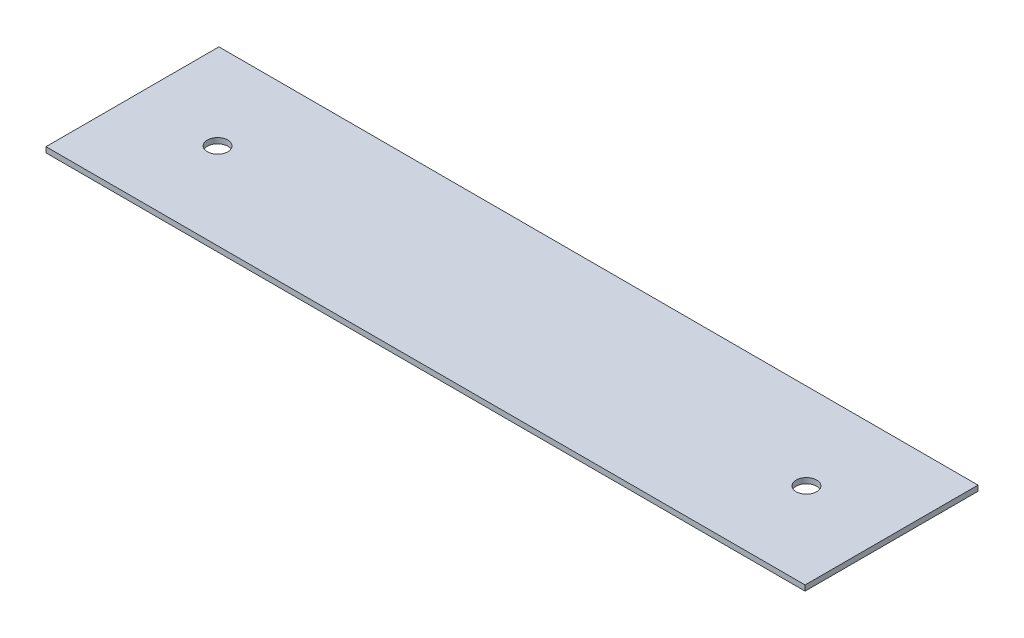
from build123d import *

# Parameters (mm, degrees)
SKETCH1_W           = 446
SKETCH1_H           = 101.6
BOSS_EXTRUDE1_DEPTH = 3.175
SKETCH2_R           = 6
CUT_EXTRUDE1_DEPTH  = 10


with BuildPart() as part:
    # Sketch1 → Boss-Extrude1 (new body)
    with BuildSketch(Plane(origin=(0, 0, 0), x_dir=(1, 0, 0), z_dir=(0, 1, 0))):
        with Locations((223, 50.8)):
            Rectangle(SKETCH1_W, SKETCH1_H)
    extrude(amount=BOSS_EXTRUDE1_DEPTH)

    # Sketch2 → Cut-Extrude1 (cut)
    with BuildSketch(Plane(origin=(0, 3.175, 0), x_dir=(1, 0, 0), z_dir=(0, 1, 0))):
        with Locations(Location((50, 50.8, 0), (0, 0, 270))):
            Circle(SKETCH2_R)
        with Locations(Location((396, 50.8, 0), (0, 0, 270))):
            Circle(SKETCH2_R)
    extrude(amount=-CUT_EXTRUDE1_DEPTH, mode=Mode.SUBTRACT)


solid = part.part
